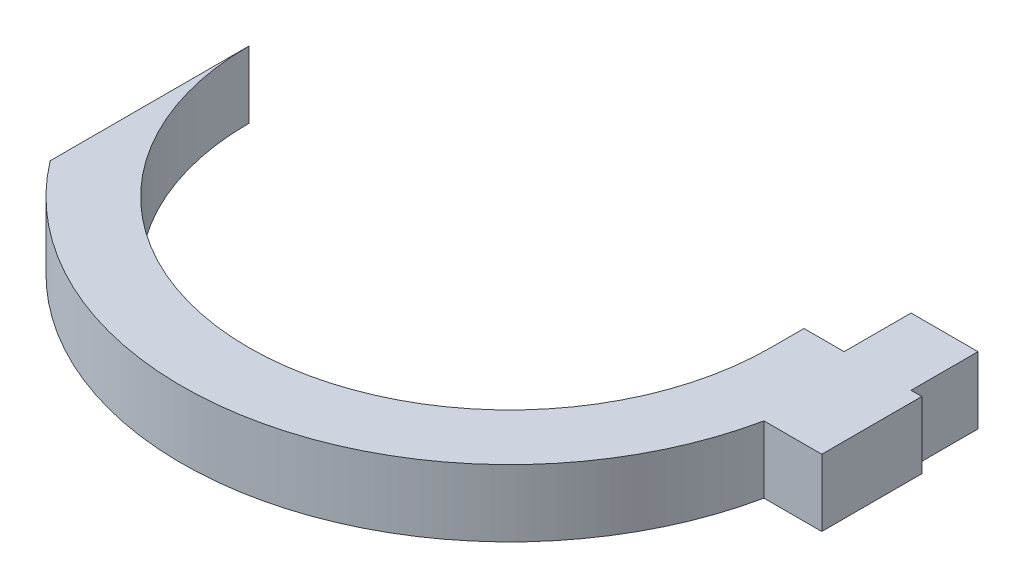
from build123d import *

# Parameters (mm, degrees)
BOSS_EXTRUDE1_DEPTH = 6.35


with BuildPart() as part:
    # Sketch1 → Boss-Extrude1 (new body)
    with BuildSketch(Plane(origin=(0, 0, 0), x_dir=(1, 0, 0), z_dir=(0, 1, 0))):
        with BuildLine():
            Line((53.34, 3.137679315), (53.34, 9.487679315))
            Line((53.34, 9.487679315), (59.69, 9.487679315))
            Line((59.69, 9.487679315), (59.69, 3.137679315))
            Line((59.69, 3.137679315), (60.706, 3.137679315))
            Line((60.706, 3.137679315), (60.706, 0))
            Line((60.706, 0), (60.706, -6.35))
            Line((60.706, -6.35), (55.225149786, -6.35))
            ThreePointArc((55.225149786, -6.35), (31.627279146, -30.348844293), (0, -18.837144157))
            Line((0, -18.837144157), (0, 0))
            ThreePointArc((0, 0), (24.765, -24.765), (49.53, 0))
            Line((49.53, 0), (49.53, 3.137679315))
            Line((49.53, 3.137679315), (53.34, 3.137679315))
        make_face()
    extrude(amount=BOSS_EXTRUDE1_DEPTH)


solid = part.part
